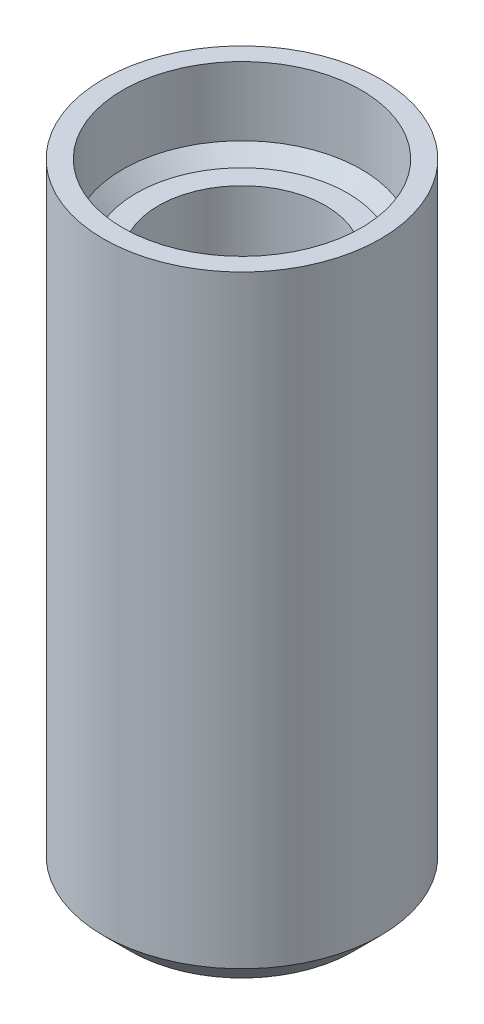
from build123d import *

# Parameters (mm, degrees)
SKETCH1_R           = 5.05
BOSS_EXTRUDE1_DEPTH = 20
SKETCH2_R           = 5.05
BOSS_EXTRUDE2_DEPTH = 2
SKETCH4_R           = 5.05
SKETCH4_R_2         = 4.35
BOSS_EXTRUDE3_DEPTH = 3
CHAMFER1_SIZE       = 1
CHAMFER2_SIZE       = 0.5
CUT_EXTRUDE1_DEPTH  = 0.4
BOSS_EXTRUDE4_DEPTH = 0.4


with BuildPart() as part:
    # Sketch1 → Boss-Extrude1 (new body)
    with BuildSketch(Plane(origin=(0, 0, 0), x_dir=(1, 0, 0), z_dir=(0, 1, 0))):
        Circle(SKETCH1_R)
        with BuildLine():
            Line((2.565151068, -1.65), (-2.565151068, -1.65))
            ThreePointArc((-2.565151068, -1.65), (0, 3.05), (2.565151068, -1.65))
        make_face(mode=Mode.SUBTRACT)
    extrude(amount=BOSS_EXTRUDE1_DEPTH)

    # Sketch2 → Boss-Extrude2 (add)
    with BuildSketch(Plane.XZ):
        Circle(SKETCH2_R)
    extrude(amount=-BOSS_EXTRUDE2_DEPTH)

    # Sketch4 → Boss-Extrude3 (add)
    with BuildSketch(Plane(origin=(0, 20, 0), x_dir=(1, 0, 0), z_dir=(0, 1, 0))):
        Circle(SKETCH4_R)
        Circle(SKETCH4_R_2, mode=Mode.SUBTRACT)
    extrude(amount=BOSS_EXTRUDE3_DEPTH)

    # Chamfer1
    chamfer1_edges = [part.edges().sort_by_distance(p)[0] for p in [
        (-5.05, 0, 0),
    ]]
    chamfer(chamfer1_edges, length=CHAMFER1_SIZE)

    # Chamfer2
    chamfer2_edges = [part.edges().sort_by_distance(p)[0] for p in [
        (-4.35, 20, 0),
    ]]
    chamfer(chamfer2_edges, length=CHAMFER2_SIZE)

    # Sketch5 → Cut-Extrude1 (cut)
    with BuildSketch(Plane.XZ):
        with BuildLine():
            add(Edge.make_bspline(
                [(1.439948587, -0.710046058), (1.438395395, -0.763123863), (1.435371319, -0.866466767), (1.412268352, -1.017339305), (1.372178749, -1.158572545), (1.31693033, -1.290456491), (1.247486351, -1.412162227), (1.164966584, -1.523686718), (1.070303614, -1.625217734), (0.963964754, -1.716938719), (0.844822113, -1.796206589), (0.716456312, -1.868431481), (0.575564043, -1.927697176), (0.424809266, -1.97769913), (0.264850981, -2.016189536), (0.097176567, -2.044509234), (-0.078033677, -2.060123547), (-0.197297495, -2.062691092), (-0.257990788, -2.063997715)],
                knots=[0, 0, 0, 0, 1.041492781, 2.0277946, 2.986615217, 3.916084947, 4.827326187, 5.730145009, 6.632774193, 7.546712009, 8.479353451, 9.436923451, 10.433370232, 11.473958583, 12.551323838, 13.6590864, 14.808710327, 16, 16, 16, 16], degree=3))
            add(Edge.make_bspline(
                [(-0.257990788, -2.063997715), (-0.330685355, -2.062816977), (-0.471948173, -2.060522523), (-0.67536247, -2.043814477), (-0.859982985, -2.016386903), (-1.022718913, -1.985492272), (-1.160257552, -1.949285133), (-1.258441832, -1.918476493), (-1.32286176, -1.893995069), (-1.358314509, -1.875077199), (-1.38746681, -1.860963293), (-1.413473366, -1.841643122), (-1.435322582, -1.814738957), (-1.457027593, -1.780919694), (-1.469277026, -1.740504741), (-1.483859207, -1.695412617), (-1.493108416, -1.64027817), (-1.499974294, -1.573513412), (-1.503712642, -1.493056815), (-1.503864117, -1.434689271), (-1.503946302, -1.403021315)],
                knots=[0, 0, 0, 0, 2.385463348, 4.63552214, 6.691379175, 8.508363939, 10.068373641, 11.355199768, 11.885343137, 12.325603242, 12.673057316, 12.946516072, 13.380756177, 13.802840454, 14.256089577, 14.757944138, 15.358657778, 16.084637987, 16.960799159, 18, 18, 18, 18], degree=3))
            add(Edge.make_bspline(
                [(-1.503946302, -1.403021315), (-1.503560463, -1.377013178), (-1.502852248, -1.329274706), (-1.498003037, -1.264124541), (-1.490800343, -1.211740708), (-1.479506898, -1.171030993), (-1.462431536, -1.141616651), (-1.443909816, -1.119534367), (-1.420010982, -1.106079345), (-1.402776497, -1.104725389), (-1.393950229, -1.10403199)],
                knots=[0, 0, 0, 0, 1.790768318, 3.286992072, 4.494486466, 5.430989523, 6.17113783, 6.821101772, 7.396252803, 8, 8, 8, 8], degree=3))
            add(Edge.make_bspline(
                [(-1.393950229, -1.10403199), (-1.387257912, -1.104891797), (-1.371655469, -1.106896347), (-1.345055777, -1.114413489), (-1.312739772, -1.127470281), (-1.258326945, -1.154567482), (-1.174574562, -1.190364129), (-1.056351571, -1.236040582), (-0.914899175, -1.279515457), (-0.783427406, -1.316265408), (-0.666028319, -1.338080135), (-0.569656297, -1.351412314), (-0.467068303, -1.357839991), (-0.396991985, -1.359281969), (-0.360987111, -1.36002285)],
                knots=[0, 0, 0, 0, 0.226170732, 0.52729361, 0.923950562, 1.394186568, 2.566047078, 3.978394295, 5.644273913, 7.529535004, 8.553841311, 9.648332238, 10.791724437, 12, 12, 12, 12], degree=3))
            add(Edge.make_bspline(
                [(-0.360987111, -1.36002285), (-0.330641359, -1.359372091), (-0.271509027, -1.35810401), (-0.18553261, -1.350456604), (-0.105064764, -1.336164935), (-0.007353655, -1.31190816), (0.102599871, -1.268255016), (0.199463492, -1.208491581), (0.263387843, -1.151120845), (0.305227716, -1.105128644), (0.338769112, -1.05363751), (0.377202905, -0.980046285), (0.410064421, -0.876621376), (0.413977935, -0.789651177), (0.415985147, -0.745044808)],
                knots=[0, 0, 0, 0, 0.976466172, 1.902761238, 2.773765462, 3.603517434, 5.138967444, 6.561136168, 7.237124531, 7.897970486, 8.55532634, 9.207676539, 10.567838014, 12, 12, 12, 12], degree=3))
            add(Edge.make_bspline(
                [(0.415985147, -0.745044808), (0.415138137, -0.720344037), (0.413469958, -0.671696094), (0.402695453, -0.600755117), (0.383373794, -0.533597512), (0.356188263, -0.470627291), (0.322097831, -0.410874731), (0.279830303, -0.355979319), (0.230455642, -0.305219556), (0.172665235, -0.260555314), (0.108447325, -0.219012872), (0.035875493, -0.183196798), (-0.044484769, -0.152236682), (-0.132534843, -0.126644897), (-0.2282998, -0.105246319), (-0.331964014, -0.0908394), (-0.443815669, -0.08158816), (-0.520961364, -0.080587588), (-0.56097997, -0.080068551)],
                knots=[0, 0, 0, 0, 0.89089672, 1.75461298, 2.58026117, 3.404244835, 4.222861616, 5.054787265, 5.896384784, 6.769420796, 7.683141108, 8.650860844, 9.682268865, 10.785377137, 11.954998644, 13.218181726, 14.556957852, 16, 16, 16, 16], degree=3))
            Line((-0.56097997, -0.080068551), (-0.95196601, -0.080068551))
            add(Edge.make_bspline(
                [(-0.95196601, -0.080068551), (-0.965945777, -0.079347472), (-0.992169308, -0.077994857), (-1.029740294, -0.071887606), (-1.060592913, -0.051285251), (-1.085426831, -0.019481253), (-1.10230797, 0.026062007), (-1.114233156, 0.085336864), (-1.118873815, 0.160858827), (-1.119573305, 0.216924425), (-1.119960012, 0.247919738)],
                knots=[0, 0, 0, 0, 0.79308653, 1.487687939, 2.114642529, 2.838260568, 3.733667445, 4.83079756, 6.247937647, 8, 8, 8, 8], degree=3))
            add(Edge.make_bspline(
                [(-1.119960012, 0.247919738), (-1.119738535, 0.276930027), (-1.119338016, 0.32939215), (-1.112864452, 0.400469752), (-1.101301785, 0.455925656), (-1.086006624, 0.498631255), (-1.063053228, 0.528682628), (-1.033871568, 0.547509269), (-0.999497914, 0.559122291), (-0.974404706, 0.559634356), (-0.960965689, 0.559908599)],
                knots=[0, 0, 0, 0, 1.741750126, 3.149775881, 4.276488068, 5.138753266, 5.851461045, 6.500941457, 7.197158351, 8, 8, 8, 8], degree=3))
            Line((-0.960965689, 0.559908599), (-0.561979935, 0.559908599))
            add(Edge.make_bspline(
                [(-0.561979935, 0.559908599), (-0.528969123, 0.560561686), (-0.464515838, 0.561836831), (-0.370564534, 0.569494587), (-0.282457341, 0.583764388), (-0.199937552, 0.602135391), (-0.124057617, 0.627709589), (-0.053694281, 0.656064693), (0.009963843, 0.690382921), (0.06693564, 0.729642531), (0.118780444, 0.772329524), (0.162292382, 0.820992827), (0.201485109, 0.872079617), (0.232090673, 0.928761378), (0.25723584, 0.988617983), (0.275559018, 1.051974094), (0.285240054, 1.118592372), (0.287062599, 1.163859224), (0.287989717, 1.186886213)],
                knots=[0, 0, 0, 0, 1.332917476, 2.602508262, 3.801673442, 4.934435479, 6.011130419, 7.030807204, 7.994227283, 8.923681384, 9.821417638, 10.697715368, 11.553625213, 12.41501901, 13.289765312, 14.171522894, 15.06986416, 16, 16, 16, 16], degree=3))
            add(Edge.make_bspline(
                [(0.287989717, 1.186886213), (0.286469492, 1.222107821), (0.283447287, 1.29212829), (0.252959762, 1.392012577), (0.207560517, 1.483771682), (0.141407472, 1.562591894), (0.056263036, 1.6286607), (-0.051148453, 1.675475914), (-0.178164753, 1.707690539), (-0.270092091, 1.710417165), (-0.318988611, 1.711867468)],
                knots=[0, 0, 0, 0, 0.93045579, 1.849743768, 2.742139225, 3.626153135, 4.551526381, 5.57085846, 6.707929868, 8, 8, 8, 8], degree=3))
            add(Edge.make_bspline(
                [(-0.318988611, 1.711867468), (-0.376261442, 1.709984747), (-0.488803519, 1.706285169), (-0.649089952, 1.664916852), (-0.795515524, 1.613070009), (-0.926581805, 1.556330466), (-1.040130541, 1.49938311), (-1.122471793, 1.453611026), (-1.178524977, 1.421307961), (-1.213400839, 1.405714249), (-1.242248375, 1.394139535), (-1.260217733, 1.392559292), (-1.267954728, 1.391878893)],
                knots=[0, 0, 0, 0, 1.692851243, 3.326481149, 4.875633421, 6.295533233, 7.554214611, 8.63713989, 9.087961584, 9.468005232, 9.770941144, 10, 10, 10, 10], degree=3))
            add(Edge.make_bspline(
                [(-1.267954728, 1.391878893), (-1.276295556, 1.392559664), (-1.292390903, 1.39387335), (-1.316786006, 1.401309238), (-1.335129295, 1.422292), (-1.352064417, 1.451260532), (-1.361186868, 1.494621751), (-1.370826706, 1.551120761), (-1.37466246, 1.624848509), (-1.375491362, 1.679545652), (-1.375950872, 1.70986754)],
                knots=[0, 0, 0, 0, 0.544926314, 1.051547597, 1.602457595, 2.300384307, 3.219077597, 4.446569629, 6.030121648, 8, 8, 8, 8], degree=3))
            add(Edge.make_bspline(
                [(-1.375950872, 1.70986754), (-1.375603407, 1.735525418), (-1.374976043, 1.781851889), (-1.374306385, 1.845393726), (-1.367694155, 1.89706397), (-1.360439817, 1.939809242), (-1.349045568, 1.975009731), (-1.334535258, 2.006058447), (-1.312797622, 2.035417506), (-1.288931753, 2.060859975), (-1.261861849, 2.084506568), (-1.2305485, 2.10410544), (-1.192257133, 2.130167721), (-1.124926502, 2.170482447), (-1.0219307, 2.222981794), (-0.876540484, 2.281407563), (-0.706072191, 2.335392856), (-0.511113732, 2.378232655), (-0.295395126, 2.411248792), (-0.144132665, 2.414277728), (-0.065997644, 2.415842333)],
                knots=[0, 0, 0, 0, 0.831243847, 1.500848755, 2.055163156, 2.516681738, 2.902423399, 3.250031968, 3.621461942, 4.079686637, 4.378246769, 4.782427033, 5.273426863, 5.878783658, 7.322258244, 9.012066047, 10.947769655, 13.105609809, 15.471789883, 18, 18, 18, 18], degree=3))
            add(Edge.make_bspline(
                [(-0.065997644, 2.415842333), (-0.014646506, 2.414721505), (0.085555046, 2.412534431), (0.231070315, 2.400277276), (0.367359493, 2.376828149), (0.494633036, 2.345365431), (0.612420893, 2.304043398), (0.721540283, 2.256595263), (0.82003127, 2.199307384), (0.908363064, 2.133687187), (0.988592163, 2.061674135), (1.057428056, 1.980373981), (1.116471535, 1.891199315), (1.163769461, 1.794070545), (1.202458441, 1.690419719), (1.2289961, 1.579964326), (1.245523386, 1.463046905), (1.247131361, 1.38293682), (1.247955442, 1.341880679)],
                knots=[0, 0, 0, 0, 1.280928197, 2.499477094, 3.637948789, 4.726741803, 5.765243399, 6.747765652, 7.690257354, 8.599760521, 9.488354541, 10.372934014, 11.249113775, 12.148837875, 13.061526967, 14.003138316, 14.976615292, 16, 16, 16, 16], degree=3))
            add(Edge.make_bspline(
                [(1.247955442, 1.341880679), (1.247495698, 1.309850279), (1.246588228, 1.246626792), (1.235884359, 1.153465287), (1.220539716, 1.063366132), (1.1971929, 0.977214436), (1.168224432, 0.894933859), (1.133408105, 0.816830516), (1.091996224, 0.743345983), (1.045030366, 0.674293618), (0.992173642, 0.609610877), (0.931140251, 0.551779743), (0.865320976, 0.497431001), (0.792846205, 0.448577352), (0.715094295, 0.403984608), (0.630390599, 0.367871477), (0.540941381, 0.334753547), (0.478162859, 0.318994965), (0.445984076, 0.310917489)],
                knots=[0, 0, 0, 0, 1.079184165, 2.130157228, 3.157254539, 4.15751249, 5.134787611, 6.095384903, 7.036128748, 7.974184748, 8.907856497, 9.845508656, 10.80367147, 11.782237576, 12.788472904, 13.819802145, 14.882482248, 16, 16, 16, 16], degree=3))
            Line((0.445984076, 0.310917489), (0.445984076, 0.300917846))
            add(Edge.make_bspline(
                [(0.445984076, 0.300917846), (0.483787302, 0.296002755), (0.558018199, 0.286351419), (0.665049524, 0.259322774), (0.766743249, 0.226967908), (0.861645088, 0.185390689), (0.950812722, 0.138693166), (1.033149469, 0.085887741), (1.107697554, 0.026054685), (1.175402009, -0.038429159), (1.235972573, -0.108081676), (1.289074159, -0.181960655), (1.334350835, -0.260802379), (1.372501361, -0.343708621), (1.402127169, -0.430590322), (1.424800915, -0.520761554), (1.437828498, -0.61432953), (1.439238964, -0.678008439), (1.439948587, -0.710046058)],
                knots=[0, 0, 0, 0, 1.172328645, 2.301999484, 3.392078591, 4.453589995, 5.486151113, 6.487823821, 7.458763684, 8.423832188, 9.361912792, 10.29572017, 11.219555772, 12.156064298, 13.10018411, 14.040729813, 15.014267802, 16, 16, 16, 16], degree=3))
        make_face()
    extrude(amount=-CUT_EXTRUDE1_DEPTH, mode=Mode.SUBTRACT)


with BuildPart() as body_2:
    # Sketch5<2> → Boss-Extrude4 (new body)
    with BuildSketch(Plane.XZ):
        with BuildLine():
            add(Edge.make_bspline(
                [(1.439948587, -0.710046058), (1.438395395, -0.763123863), (1.435371319, -0.866466767), (1.412268352, -1.017339305), (1.372178749, -1.158572545), (1.31693033, -1.290456491), (1.247486351, -1.412162227), (1.164966584, -1.523686718), (1.070303614, -1.625217734), (0.963964754, -1.716938719), (0.844822113, -1.796206589), (0.716456312, -1.868431481), (0.575564043, -1.927697176), (0.424809266, -1.97769913), (0.264850981, -2.016189536), (0.097176567, -2.044509234), (-0.078033677, -2.060123547), (-0.197297495, -2.062691092), (-0.257990788, -2.063997715)],
                knots=[0, 0, 0, 0, 1.041492781, 2.0277946, 2.986615217, 3.916084947, 4.827326187, 5.730145009, 6.632774193, 7.546712009, 8.479353451, 9.436923451, 10.433370232, 11.473958583, 12.551323838, 13.6590864, 14.808710327, 16, 16, 16, 16], degree=3))
            add(Edge.make_bspline(
                [(-0.257990788, -2.063997715), (-0.330685355, -2.062816977), (-0.471948173, -2.060522523), (-0.67536247, -2.043814477), (-0.859982985, -2.016386903), (-1.022718913, -1.985492272), (-1.160257552, -1.949285133), (-1.258441832, -1.918476493), (-1.32286176, -1.893995069), (-1.358314509, -1.875077199), (-1.38746681, -1.860963293), (-1.413473366, -1.841643122), (-1.435322582, -1.814738957), (-1.457027593, -1.780919694), (-1.469277026, -1.740504741), (-1.483859207, -1.695412617), (-1.493108416, -1.64027817), (-1.499974294, -1.573513412), (-1.503712642, -1.493056815), (-1.503864117, -1.434689271), (-1.503946302, -1.403021315)],
                knots=[0, 0, 0, 0, 2.385463348, 4.63552214, 6.691379175, 8.508363939, 10.068373641, 11.355199768, 11.885343137, 12.325603242, 12.673057316, 12.946516072, 13.380756177, 13.802840454, 14.256089577, 14.757944138, 15.358657778, 16.084637987, 16.960799159, 18, 18, 18, 18], degree=3))
            add(Edge.make_bspline(
                [(-1.503946302, -1.403021315), (-1.503560463, -1.377013178), (-1.502852248, -1.329274706), (-1.498003037, -1.264124541), (-1.490800343, -1.211740708), (-1.479506898, -1.171030993), (-1.462431536, -1.141616651), (-1.443909816, -1.119534367), (-1.420010982, -1.106079345), (-1.402776497, -1.104725389), (-1.393950229, -1.10403199)],
                knots=[0, 0, 0, 0, 1.790768318, 3.286992072, 4.494486466, 5.430989523, 6.17113783, 6.821101772, 7.396252803, 8, 8, 8, 8], degree=3))
            add(Edge.make_bspline(
                [(-1.393950229, -1.10403199), (-1.387257912, -1.104891797), (-1.371655469, -1.106896347), (-1.345055777, -1.114413489), (-1.312739772, -1.127470281), (-1.258326945, -1.154567482), (-1.174574562, -1.190364129), (-1.056351571, -1.236040582), (-0.914899175, -1.279515457), (-0.783427406, -1.316265408), (-0.666028319, -1.338080135), (-0.569656297, -1.351412314), (-0.467068303, -1.357839991), (-0.396991985, -1.359281969), (-0.360987111, -1.36002285)],
                knots=[0, 0, 0, 0, 0.226170732, 0.52729361, 0.923950562, 1.394186568, 2.566047078, 3.978394295, 5.644273913, 7.529535004, 8.553841311, 9.648332238, 10.791724437, 12, 12, 12, 12], degree=3))
            add(Edge.make_bspline(
                [(-0.360987111, -1.36002285), (-0.330641359, -1.359372091), (-0.271509027, -1.35810401), (-0.18553261, -1.350456604), (-0.105064764, -1.336164935), (-0.007353655, -1.31190816), (0.102599871, -1.268255016), (0.199463492, -1.208491581), (0.263387843, -1.151120845), (0.305227716, -1.105128644), (0.338769112, -1.05363751), (0.377202905, -0.980046285), (0.410064421, -0.876621376), (0.413977935, -0.789651177), (0.415985147, -0.745044808)],
                knots=[0, 0, 0, 0, 0.976466172, 1.902761238, 2.773765462, 3.603517434, 5.138967444, 6.561136168, 7.237124531, 7.897970486, 8.55532634, 9.207676539, 10.567838014, 12, 12, 12, 12], degree=3))
            add(Edge.make_bspline(
                [(0.415985147, -0.745044808), (0.415138137, -0.720344037), (0.413469958, -0.671696094), (0.402695453, -0.600755117), (0.383373794, -0.533597512), (0.356188263, -0.470627291), (0.322097831, -0.410874731), (0.279830303, -0.355979319), (0.230455642, -0.305219556), (0.172665235, -0.260555314), (0.108447325, -0.219012872), (0.035875493, -0.183196798), (-0.044484769, -0.152236682), (-0.132534843, -0.126644897), (-0.2282998, -0.105246319), (-0.331964014, -0.0908394), (-0.443815669, -0.08158816), (-0.520961364, -0.080587588), (-0.56097997, -0.080068551)],
                knots=[0, 0, 0, 0, 0.89089672, 1.75461298, 2.58026117, 3.404244835, 4.222861616, 5.054787265, 5.896384784, 6.769420796, 7.683141108, 8.650860844, 9.682268865, 10.785377137, 11.954998644, 13.218181726, 14.556957852, 16, 16, 16, 16], degree=3))
            Line((-0.56097997, -0.080068551), (-0.95196601, -0.080068551))
            add(Edge.make_bspline(
                [(-0.95196601, -0.080068551), (-0.965945777, -0.079347472), (-0.992169308, -0.077994857), (-1.029740294, -0.071887606), (-1.060592913, -0.051285251), (-1.085426831, -0.019481253), (-1.10230797, 0.026062007), (-1.114233156, 0.085336864), (-1.118873815, 0.160858827), (-1.119573305, 0.216924425), (-1.119960012, 0.247919738)],
                knots=[0, 0, 0, 0, 0.79308653, 1.487687939, 2.114642529, 2.838260568, 3.733667445, 4.83079756, 6.247937647, 8, 8, 8, 8], degree=3))
            add(Edge.make_bspline(
                [(-1.119960012, 0.247919738), (-1.119738535, 0.276930027), (-1.119338016, 0.32939215), (-1.112864452, 0.400469752), (-1.101301785, 0.455925656), (-1.086006624, 0.498631255), (-1.063053228, 0.528682628), (-1.033871568, 0.547509269), (-0.999497914, 0.559122291), (-0.974404706, 0.559634356), (-0.960965689, 0.559908599)],
                knots=[0, 0, 0, 0, 1.741750126, 3.149775881, 4.276488068, 5.138753266, 5.851461045, 6.500941457, 7.197158351, 8, 8, 8, 8], degree=3))
            Line((-0.960965689, 0.559908599), (-0.561979935, 0.559908599))
            add(Edge.make_bspline(
                [(-0.561979935, 0.559908599), (-0.528969123, 0.560561686), (-0.464515838, 0.561836831), (-0.370564534, 0.569494587), (-0.282457341, 0.583764388), (-0.199937552, 0.602135391), (-0.124057617, 0.627709589), (-0.053694281, 0.656064693), (0.009963843, 0.690382921), (0.06693564, 0.729642531), (0.118780444, 0.772329524), (0.162292382, 0.820992827), (0.201485109, 0.872079617), (0.232090673, 0.928761378), (0.25723584, 0.988617983), (0.275559018, 1.051974094), (0.285240054, 1.118592372), (0.287062599, 1.163859224), (0.287989717, 1.186886213)],
                knots=[0, 0, 0, 0, 1.332917476, 2.602508262, 3.801673442, 4.934435479, 6.011130419, 7.030807204, 7.994227283, 8.923681384, 9.821417638, 10.697715368, 11.553625213, 12.41501901, 13.289765312, 14.171522894, 15.06986416, 16, 16, 16, 16], degree=3))
            add(Edge.make_bspline(
                [(0.287989717, 1.186886213), (0.286469492, 1.222107821), (0.283447287, 1.29212829), (0.252959762, 1.392012577), (0.207560517, 1.483771682), (0.141407472, 1.562591894), (0.056263036, 1.6286607), (-0.051148453, 1.675475914), (-0.178164753, 1.707690539), (-0.270092091, 1.710417165), (-0.318988611, 1.711867468)],
                knots=[0, 0, 0, 0, 0.93045579, 1.849743768, 2.742139225, 3.626153135, 4.551526381, 5.57085846, 6.707929868, 8, 8, 8, 8], degree=3))
            add(Edge.make_bspline(
                [(-0.318988611, 1.711867468), (-0.376261442, 1.709984747), (-0.488803519, 1.706285169), (-0.649089952, 1.664916852), (-0.795515524, 1.613070009), (-0.926581805, 1.556330466), (-1.040130541, 1.49938311), (-1.122471793, 1.453611026), (-1.178524977, 1.421307961), (-1.213400839, 1.405714249), (-1.242248375, 1.394139535), (-1.260217733, 1.392559292), (-1.267954728, 1.391878893)],
                knots=[0, 0, 0, 0, 1.692851243, 3.326481149, 4.875633421, 6.295533233, 7.554214611, 8.63713989, 9.087961584, 9.468005232, 9.770941144, 10, 10, 10, 10], degree=3))
            add(Edge.make_bspline(
                [(-1.267954728, 1.391878893), (-1.276295556, 1.392559664), (-1.292390903, 1.39387335), (-1.316786006, 1.401309238), (-1.335129295, 1.422292), (-1.352064417, 1.451260532), (-1.361186868, 1.494621751), (-1.370826706, 1.551120761), (-1.37466246, 1.624848509), (-1.375491362, 1.679545652), (-1.375950872, 1.70986754)],
                knots=[0, 0, 0, 0, 0.544926314, 1.051547597, 1.602457595, 2.300384307, 3.219077597, 4.446569629, 6.030121648, 8, 8, 8, 8], degree=3))
            add(Edge.make_bspline(
                [(-1.375950872, 1.70986754), (-1.375603407, 1.735525418), (-1.374976043, 1.781851889), (-1.374306385, 1.845393726), (-1.367694155, 1.89706397), (-1.360439817, 1.939809242), (-1.349045568, 1.975009731), (-1.334535258, 2.006058447), (-1.312797622, 2.035417506), (-1.288931753, 2.060859975), (-1.261861849, 2.084506568), (-1.2305485, 2.10410544), (-1.192257133, 2.130167721), (-1.124926502, 2.170482447), (-1.0219307, 2.222981794), (-0.876540484, 2.281407563), (-0.706072191, 2.335392856), (-0.511113732, 2.378232655), (-0.295395126, 2.411248792), (-0.144132665, 2.414277728), (-0.065997644, 2.415842333)],
                knots=[0, 0, 0, 0, 0.831243847, 1.500848755, 2.055163156, 2.516681738, 2.902423399, 3.250031968, 3.621461942, 4.079686637, 4.378246769, 4.782427033, 5.273426863, 5.878783658, 7.322258244, 9.012066047, 10.947769655, 13.105609809, 15.471789883, 18, 18, 18, 18], degree=3))
            add(Edge.make_bspline(
                [(-0.065997644, 2.415842333), (-0.014646506, 2.414721505), (0.085555046, 2.412534431), (0.231070315, 2.400277276), (0.367359493, 2.376828149), (0.494633036, 2.345365431), (0.612420893, 2.304043398), (0.721540283, 2.256595263), (0.82003127, 2.199307384), (0.908363064, 2.133687187), (0.988592163, 2.061674135), (1.057428056, 1.980373981), (1.116471535, 1.891199315), (1.163769461, 1.794070545), (1.202458441, 1.690419719), (1.2289961, 1.579964326), (1.245523386, 1.463046905), (1.247131361, 1.38293682), (1.247955442, 1.341880679)],
                knots=[0, 0, 0, 0, 1.280928197, 2.499477094, 3.637948789, 4.726741803, 5.765243399, 6.747765652, 7.690257354, 8.599760521, 9.488354541, 10.372934014, 11.249113775, 12.148837875, 13.061526967, 14.003138316, 14.976615292, 16, 16, 16, 16], degree=3))
            add(Edge.make_bspline(
                [(1.247955442, 1.341880679), (1.247495698, 1.309850279), (1.246588228, 1.246626792), (1.235884359, 1.153465287), (1.220539716, 1.063366132), (1.1971929, 0.977214436), (1.168224432, 0.894933859), (1.133408105, 0.816830516), (1.091996224, 0.743345983), (1.045030366, 0.674293618), (0.992173642, 0.609610877), (0.931140251, 0.551779743), (0.865320976, 0.497431001), (0.792846205, 0.448577352), (0.715094295, 0.403984608), (0.630390599, 0.367871477), (0.540941381, 0.334753547), (0.478162859, 0.318994965), (0.445984076, 0.310917489)],
                knots=[0, 0, 0, 0, 1.079184165, 2.130157228, 3.157254539, 4.15751249, 5.134787611, 6.095384903, 7.036128748, 7.974184748, 8.907856497, 9.845508656, 10.80367147, 11.782237576, 12.788472904, 13.819802145, 14.882482248, 16, 16, 16, 16], degree=3))
            Line((0.445984076, 0.310917489), (0.445984076, 0.300917846))
            add(Edge.make_bspline(
                [(0.445984076, 0.300917846), (0.483787302, 0.296002755), (0.558018199, 0.286351419), (0.665049524, 0.259322774), (0.766743249, 0.226967908), (0.861645088, 0.185390689), (0.950812722, 0.138693166), (1.033149469, 0.085887741), (1.107697554, 0.026054685), (1.175402009, -0.038429159), (1.235972573, -0.108081676), (1.289074159, -0.181960655), (1.334350835, -0.260802379), (1.372501361, -0.343708621), (1.402127169, -0.430590322), (1.424800915, -0.520761554), (1.437828498, -0.61432953), (1.439238964, -0.678008439), (1.439948587, -0.710046058)],
                knots=[0, 0, 0, 0, 1.172328645, 2.301999484, 3.392078591, 4.453589995, 5.486151113, 6.487823821, 7.458763684, 8.423832188, 9.361912792, 10.29572017, 11.219555772, 12.156064298, 13.10018411, 14.040729813, 15.014267802, 16, 16, 16, 16], degree=3))
        make_face()
    extrude(amount=-BOSS_EXTRUDE4_DEPTH)


solid = Compound([part.part, body_2.part])
